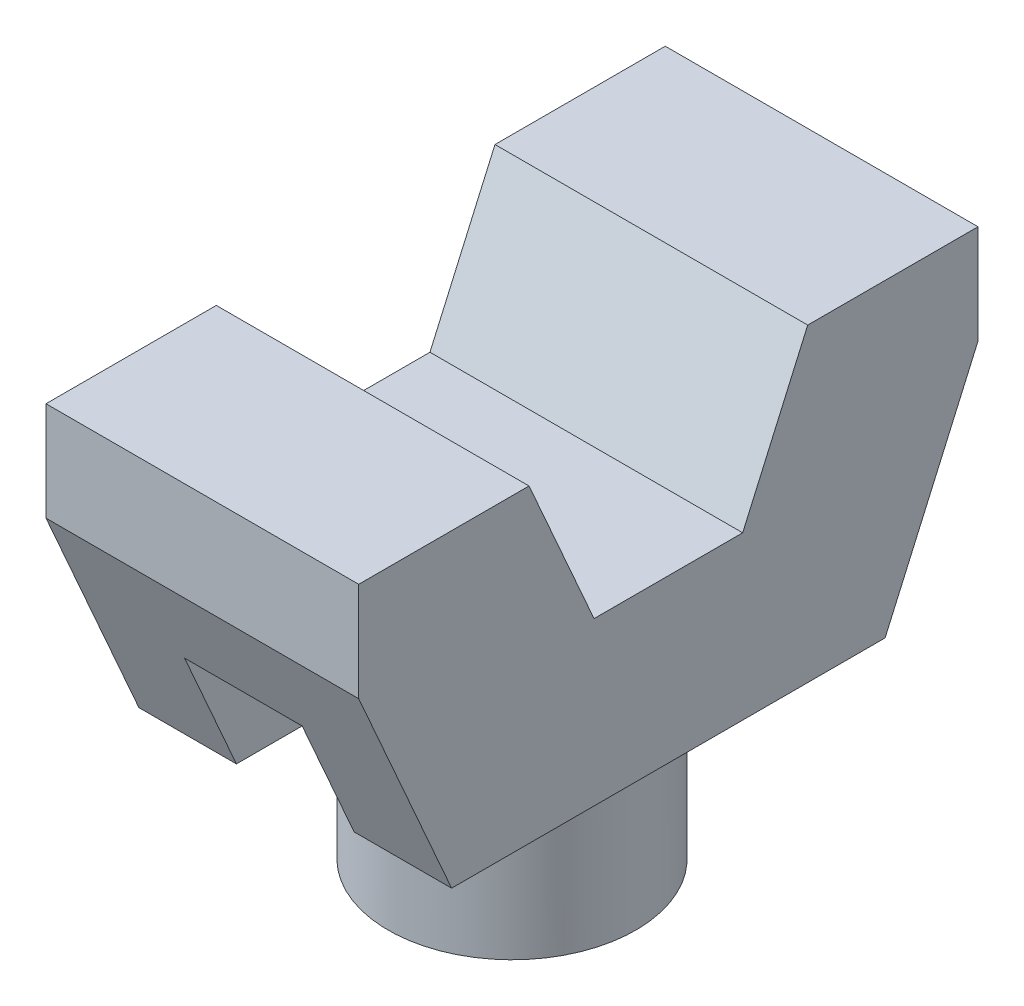
from build123d import *

# Parameters (mm, degrees)
BOSS_EXTRUDE1_DEPTH = 50.5
SKETCH2_R           = 20
BOSS_EXTRUDE2_DEPTH = 26
SKETCH4_W           = 19
SKETCH4_H           = 19
CUT_EXTRUDE1_DEPTH  = 30
SKETCH5_W           = 19
SKETCH5_H           = 19
CUT_EXTRUDE2_DEPTH  = 30


with BuildPart() as part:
    # Sketch1 → Boss-Extrude1 (new body)
    with BuildSketch(Plane(origin=(0, 0, 0), x_dir=(0, 0, -1), z_dir=(1, 0, 0))):
        Polygon((-12, 0), (12, 0), (22.5, 23.8), (50, 23.8), (50, 7.8), (35, -26.2), (-35, -26.2), (-50, 7.8), (-50, 23.8), (-22.5, 23.8), align=None)
    extrude(amount=-BOSS_EXTRUDE1_DEPTH)

    # Sketch2 → Boss-Extrude2 (add)
    with BuildSketch(Plane.XZ.offset(26.2)):
        with Locations(Location((-25.25, 0, 0), (0, 0, 90))):
            Circle(SKETCH2_R)
    extrude(amount=BOSS_EXTRUDE2_DEPTH)

    # Sketch4 → Cut-Extrude1 (cut)
    with BuildSketch(Plane.XY.offset(50)):
        with Locations((-25.25, -16.7)):
            Rectangle(SKETCH4_W, SKETCH4_H)
    extrude(amount=-CUT_EXTRUDE1_DEPTH, mode=Mode.SUBTRACT)

    # Sketch5 → Cut-Extrude2 (cut)
    with BuildSketch(Plane(origin=(0, 0, -50), x_dir=(-1, 0, 0), z_dir=(0, 0, -1))):
        with Locations((25.25, -16.7)):
            Rectangle(SKETCH5_W, SKETCH5_H)
    extrude(amount=-CUT_EXTRUDE2_DEPTH, mode=Mode.SUBTRACT)


solid = part.part
